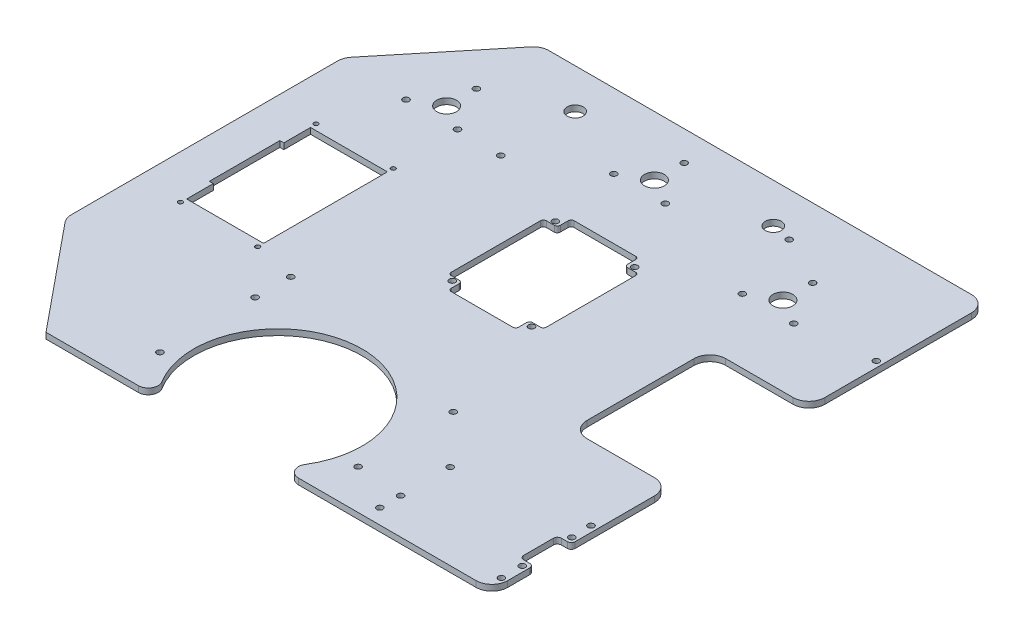
from build123d import *

# Parameters (mm, degrees)
SKETCH_1_W           = 270
SKETCH_1_H           = 250
SKETCH_1_R           = 1.55
EXTRUDE_1_DEPTH      = 3
SKETCH_2_R           = 40
CUT_EXTRUDE_1_DEPTH  = 10
CUT_EXTRUDE_3_DEPTH  = 10
SKETCH_5_R           = 5
SKETCH_5_R_2         = 1.55
CUT_EXTRUDE_4_DEPTH  = 10
SKETCH_6_R           = 42.5
CUT_EXTRUDE_5_DEPTH  = 10
SKETCH_8_W           = 100
SKETCH_8_H           = 70
CUT_EXTRUDE_7_DEPTH  = 10
SKETCH_9_R           = 1.55
CUT_EXTRUDE_8_DEPTH  = 10
SKETCH_10_R          = 1.55
CUT_EXTRUDE_9_DEPTH  = 10
SKETCH_11_R          = 1.55
CUT_EXTRUDE_10_DEPTH = 10
FILLET_3_R           = 8
SKETCH_13_W          = 34
SKETCH_13_H          = 48
SKETCH_13_W_2        = 7
SKETCH_13_H_2        = 7
SKETCH_13_R          = 1.55
CUT_EXTRUDE_12_DEPTH = 10
FILLET_4_R           = 1.5
SKETCH_15_R          = 1.55
CUT_EXTRUDE_13_DEPTH = 10
SKETCH_16_R          = 4.05
CUT_EXTRUDE_14_DEPTH = 10
CUT_EXTRUDE_START    = -10
SKETCH_19_R          = 4.05
CUT_EXTRUDE_19_DEPTH = 10
SKETCH_21_R          = 1.55
CUT_EXTRUDE_20_DEPTH = 10
SKETCH_23_W          = 7
SKETCH_23_H          = 19
CUT_EXTRUDE_22_DEPTH = 10
FILLET_8_R           = 2
SKETCH_12_W          = 2
SKETCH_12_H          = 35.6
SKETCH_12_R          = 1.1
CUT_EXTRUDE_23_DEPTH = 10
FILLET_9_R           = 5
SKETCH_26_R          = 1.55
CUT_EXTRUDE_24_DEPTH = 8


with BuildPart() as part:
    # 草图1 → 凸台-拉伸1 (new body)
    with BuildSketch(Plane(origin=(0, 0, 0), x_dir=(1, 0, 0), z_dir=(0, 1, 0))):
        Rectangle(SKETCH_1_W, SKETCH_1_H)
        with Locations(Location((132, 72, 0), (0, 0, 270))):
            Circle(SKETCH_1_R, mode=Mode.SUBTRACT)
        with Locations(Location((132, -72, 0), (0, 0, 270))):
            Circle(SKETCH_1_R, mode=Mode.SUBTRACT)
    extrude(amount=EXTRUDE_1_DEPTH)

    # 草图2 → 切除-拉伸1 (cut)
    with BuildSketch(Plane(origin=(0, 3, 0), x_dir=(1, 0, 0), z_dir=(0, 1, 0))):
        with Locations((-3, -95)):
            Circle(SKETCH_2_R)
    extrude(amount=-CUT_EXTRUDE_1_DEPTH, mode=Mode.SUBTRACT)

    # 草图4 → 切除-拉伸3 (cut)
    with BuildSketch(Plane(origin=(0, 3, 0), x_dir=(1, 0, 0), z_dir=(0, 1, 0))):
        Polygon((-90, -125), (-135, -70), (-162.976707817, -172.035264534), align=None)
        Polygon((-90, 125), (-135, 70), (-171.69806915, 153.777299788), align=None)
    extrude(amount=-CUT_EXTRUDE_3_DEPTH, mode=Mode.SUBTRACT)

    # 草图5 → 切除-拉伸4 (cut)
    with BuildSketch(Plane(origin=(0, 3, 0), x_dir=(1, 0, 0), z_dir=(0, 1, 0))):
        with Locations(Location((-87.852813742, 75, 0), (0, 0, 270))):
            Circle(SKETCH_5_R)
        with Locations(Location((-3, 95, 0), (0, 0, 270))):
            Circle(SKETCH_5_R)
        with Locations(Location((81.852813742, 75, 0), (0, 0, 270))):
            Circle(SKETCH_5_R)
        with Locations(Location((-87.852813742, 90, 0), (0, 0, 270))):
            Circle(SKETCH_5_R_2)
        with Locations(Location((-74.862432686, 67.5, 0), (0, 0, 270))):
            Circle(SKETCH_5_R_2)
        with Locations(Location((-100.843194799, 67.5, 0), (0, 0, 270))):
            Circle(SKETCH_5_R_2)
        with Locations(Location((-3, 110, 0), (0, 0, 270))):
            Circle(SKETCH_5_R_2)
        with Locations(Location((9.990381057, 87.5, 0), (0, 0, 270))):
            Circle(SKETCH_5_R_2)
        with Locations(Location((-15.990381057, 87.5, 0), (0, 0, 270))):
            Circle(SKETCH_5_R_2)
        with Locations(Location((81.852813742, 90, 0), (0, 0, 270))):
            Circle(SKETCH_5_R_2)
        with Locations(Location((94.843194799, 67.5, 0), (0, 0, 270))):
            Circle(SKETCH_5_R_2)
        with Locations(Location((68.862432686, 67.5, 0), (0, 0, 270))):
            Circle(SKETCH_5_R_2)
    extrude(amount=-CUT_EXTRUDE_4_DEPTH, mode=Mode.SUBTRACT)

    # 草图6 → 切除-拉伸5 (cut)
    with BuildSketch(Plane(origin=(0, 3, 0), x_dir=(1, 0, 0), z_dir=(0, 1, 0))):
        with Locations((-3, -95)):
            Circle(SKETCH_6_R)
    extrude(amount=-CUT_EXTRUDE_5_DEPTH, mode=Mode.SUBTRACT)

    # 草图8 → 切除-拉伸7 (cut)
    with BuildSketch(Plane(origin=(0, 3, 0), x_dir=(1, 0, 0), z_dir=(0, 1, 0))):
        with Locations((135, 0)):
            Rectangle(SKETCH_8_W, SKETCH_8_H)
    extrude(amount=-CUT_EXTRUDE_7_DEPTH, mode=Mode.SUBTRACT)

    # 草图9 → 切除-拉伸8 (cut)
    with BuildSketch(Plane(origin=(0, 3, 0), x_dir=(1, 0, 0), z_dir=(0, 1, 0))):
        with Locations(Location((-52.5, 67, 0), (0, 0, 270))):
            Circle(SKETCH_9_R)
    extrude(amount=-CUT_EXTRUDE_8_DEPTH, mode=Mode.SUBTRACT)

    # 草图10 → 切除-拉伸9 (cut)
    with BuildSketch(Plane(origin=(0, 3, 0), x_dir=(1, 0, 0), z_dir=(0, 1, 0))):
        with Locations(Location((57, 103, 0), (0, 0, 270))):
            Circle(SKETCH_10_R)
    extrude(amount=-CUT_EXTRUDE_9_DEPTH, mode=Mode.SUBTRACT)

    # 草图11 → 切除-拉伸10 (cut)
    with BuildSketch(Plane(origin=(0, 3, 0), x_dir=(1, 0, 0), z_dir=(0, 1, 0))):
        with Locations(Location((-52.5, -39, 0), (0, 0, 270))):
            Circle(SKETCH_11_R)
    extrude(amount=-CUT_EXTRUDE_10_DEPTH, mode=Mode.SUBTRACT)

    # 圆角3
    fillet_3_edges = [part.edges().sort_by_distance(p)[0] for p in [
        (135, 1.5, 35),
        (135, 1.5, -35),
        (85, 1.5, 35),
        (85, 1.5, -35),
        (-135, 1.5, -70),
        (-135, 1.5, 70),
        (-90, 1.5, -125),
        (135, 1.5, 125),
        (135, 1.5, -125),
    ]]
    fillet(fillet_3_edges, radius=FILLET_3_R)

    # 草图13 → 切除-拉伸12 (cut)
    with BuildSketch(Plane(origin=(0, 3, 0), x_dir=(1, 0, 0), z_dir=(0, 1, 0))):
        with Locations((10, 26)):
            Rectangle(SKETCH_13_W, SKETCH_13_H)
        with Locations((30.5, 26)):
            Rectangle(SKETCH_13_W_2, SKETCH_13_H)
        with Locations((10, 53.5)):
            Rectangle(SKETCH_13_W, SKETCH_13_H_2)
        with Locations((-10.5, 26)):
            Rectangle(SKETCH_13_W_2, SKETCH_13_H)
        with Locations((10, -1.5)):
            Rectangle(SKETCH_13_W, SKETCH_13_H_2)
        with Locations(Location((30, 0, 0), (0, 0, 270))):
            Circle(SKETCH_13_R)
        with Locations(Location((-10, 52, 0), (0, 0, 270))):
            Circle(SKETCH_13_R)
        with Locations(Location((-10, 0, 0), (0, 0, 270))):
            Circle(SKETCH_13_R)
        with Locations(Location((30, 52, 0), (0, 0, 270))):
            Circle(SKETCH_13_R)
    extrude(amount=-CUT_EXTRUDE_12_DEPTH, mode=Mode.SUBTRACT)

    # 圆角4
    fillet_4_edges = [part.edges().sort_by_distance(p)[0] for p in [
        (-7, 1.5, -2),
        (-14, 1.5, -2),
        (-14, 1.5, -50),
        (-7, 1.5, -50),
        (-7, 1.5, -57),
        (27, 1.5, -57),
        (27, 1.5, -50),
        (34, 1.5, -50),
        (34, 1.5, -2),
        (27, 1.5, -2),
        (27, 1.5, 5),
        (-7, 1.5, 5),
    ]]
    fillet(fillet_4_edges, radius=FILLET_4_R)

    # 草图15 → 切除-拉伸13 (cut)
    with BuildSketch(Plane(origin=(0, 3, 0), x_dir=(1, 0, 0), z_dir=(0, 1, 0))):
        with Locations(Location((47.5, -105, 0), (0, 0, 270))):
            Circle(SKETCH_15_R)
        with Locations(Location((-52.5, -105, 0), (0, 0, 270))):
            Circle(SKETCH_15_R)
        with Locations(Location((47.5, -57, 0), (0, 0, 270))):
            Circle(SKETCH_15_R)
        with Locations(Location((-52.5, -57, 0), (0, 0, 270))):
            Circle(SKETCH_15_R)
    extrude(amount=-CUT_EXTRUDE_13_DEPTH, mode=Mode.SUBTRACT)

    # 草图16 → 切除-拉伸14 (cut)
    with BuildSketch(Plane.XZ):
        with Locations(Location((-53, -105, 0), (0, 0, 270))):
            Circle(SKETCH_16_R)
    extrude(amount=-CUT_EXTRUDE_14_DEPTH, mode=Mode.SUBTRACT)

    # 草图19 → 切除-拉伸19 (cut)
    with BuildSketch(Plane(origin=(0, 3, 0), x_dir=(1, 0, 0), z_dir=(0, 1, 0)).offset(CUT_EXTRUDE_START)):
        with Locations(Location((-53, 105, 0), (0, 0, 90))):
            Circle(SKETCH_19_R)
        with Locations(Location((47, 105, 0), (0, 0, 270))):
            Circle(SKETCH_19_R)
    extrude(amount=CUT_EXTRUDE_19_DEPTH, mode=Mode.SUBTRACT)

    # 草图21 → 切除-拉伸20 (cut)
    with BuildSketch(Plane(origin=(0, 0, 0), x_dir=(-1, 0, 0), z_dir=(0, -1, 0))):
        with Locations(Location((-132.26, -117.45, 0), (0, 0, 90))):
            Circle(SKETCH_21_R)
        with Locations(Location((-70.88, -117.45, 0), (0, 0, 90))):
            Circle(SKETCH_21_R)
        with Locations(Location((-70.88, -81.94, 0), (0, 0, 90))):
            Circle(SKETCH_21_R)
        with Locations(Location((-132.26, -81.94, 0), (0, 0, 90))):
            Circle(SKETCH_21_R)
    extrude(amount=-CUT_EXTRUDE_20_DEPTH, mode=Mode.SUBTRACT)

    # 草图23 → 切除-拉伸22 (cut)
    with BuildSketch(Plane(origin=(0, 0, 0), x_dir=(-1, 0, 0), z_dir=(0, -1, 0))):
        with Locations((-131.5, -94.44)):
            Rectangle(SKETCH_23_W, SKETCH_23_H)
    extrude(amount=-CUT_EXTRUDE_22_DEPTH, mode=Mode.SUBTRACT)

    # 圆角8
    fillet_8_edges = [part.edges().sort_by_distance(p)[0] for p in [
        (135, 1.5, 103.94),
        (135, 1.5, 84.94),
        (128, 1.5, 84.94),
        (128, 1.5, 103.94),
    ]]
    fillet(fillet_8_edges, radius=FILLET_8_R)

    # 草图12 → 切除-拉伸23 (cut)
    with BuildSketch(Plane(origin=(0, 3, 0), x_dir=(1, 0, 0), z_dir=(0, 1, 0))):
        with Locations((-113.775, 0)):
            Rectangle(SKETCH_12_W, SKETCH_12_H)
        with Locations((-111.775, 0)):
            Rectangle(SKETCH_12_W, SKETCH_12_H)
        Polygon((-73.975, 31.25), (-112.775, 31.25), (-112.775, 17.8), (-110.775, 17.8), (-110.775, -17.8), (-112.775, -17.8), (-112.775, -31.25), (-73.975, -31.25), align=None)
        with Locations(Location((-112.975, 34.2, 0), (0, 0, 270))):
            Circle(SKETCH_12_R)
        with Locations(Location((-73.975, 34.2, 0), (0, 0, 270))):
            Circle(SKETCH_12_R)
        with Locations(Location((-112.975, -34.2, 0), (0, 0, 270))):
            Circle(SKETCH_12_R)
        with Locations(Location((-73.975, -34.2, 0), (0, 0, 270))):
            Circle(SKETCH_12_R)
    extrude(amount=-CUT_EXTRUDE_23_DEPTH, mode=Mode.SUBTRACT)

    # 圆角9
    fillet_9_edges = [part.edges().sort_by_distance(p)[0] for p in [
        (27.103986447, 1.5, 125),
        (-33.103986447, 1.5, 125),
    ]]
    fillet(fillet_9_edges, radius=FILLET_9_R)

    # 草图26 → 切除-拉伸24 (cut)
    with BuildSketch(Plane(origin=(0, 0, 0), x_dir=(-1, 0, 0), z_dir=(0, -1, 0))):
        with Locations(Location((-132.26, -106.94, 0), (0, 0, 90))):
            Circle(SKETCH_26_R)
        with Locations(Location((-70.88, -106.94, 0), (0, 0, 90))):
            Circle(SKETCH_26_R)
    extrude(amount=-CUT_EXTRUDE_24_DEPTH, mode=Mode.SUBTRACT)


solid = part.part
